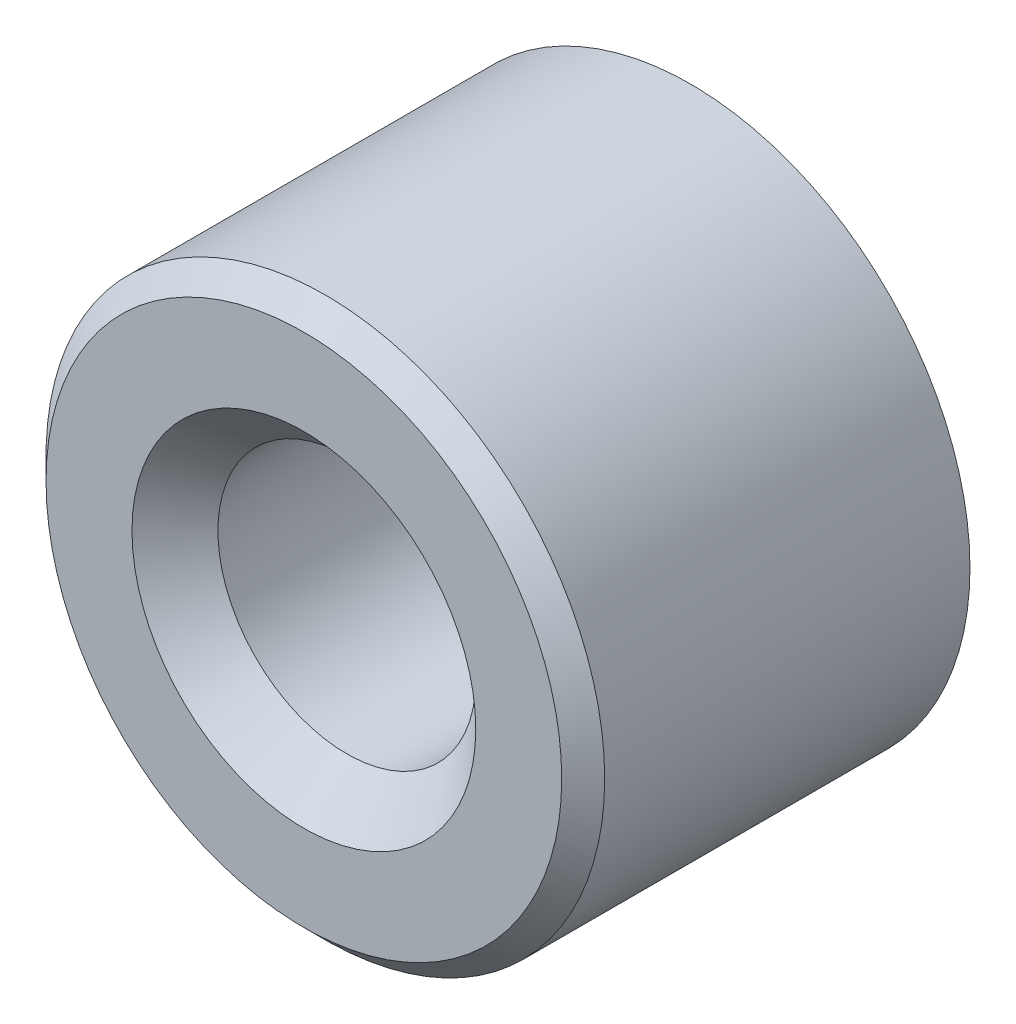
from build123d import *

# Parameters (mm, degrees)
EXTRUDE_1_DEPTH      = 2
EXTRUDE_1_DEPTH_BACK = 7
SKETCH_1_R           = 6.5
SKETCH_1_R_2         = 3
CHAMFER_1_SIZE       = 1
CHAMFER_2_SIZE       = 0.5


with BuildPart() as part:
    # Эскиз1 → Бобышка-Вытянуть1 (new, two sides: drawn at the far end of the back side and taken through both)
    with BuildSketch(Plane.XY.offset(-EXTRUDE_1_DEPTH_BACK)):
        with Locations((135, 20)):
            Circle(SKETCH_1_R)
        with Locations((135, 20)):
            Circle(SKETCH_1_R_2, mode=Mode.SUBTRACT)
    extrude(amount=EXTRUDE_1_DEPTH + EXTRUDE_1_DEPTH_BACK)

    # Фаска1
    chamfer_1_edges = [part.edges().sort_by_distance(p)[0] for p in [
        (132, 20, 2),
    ]]
    chamfer(chamfer_1_edges, length=CHAMFER_1_SIZE)

    # Фаска2
    chamfer_2_edges = [part.edges().sort_by_distance(p)[0] for p in [
        (128.5, 20, 2),
    ]]
    chamfer(chamfer_2_edges, length=CHAMFER_2_SIZE)


solid = part.part
